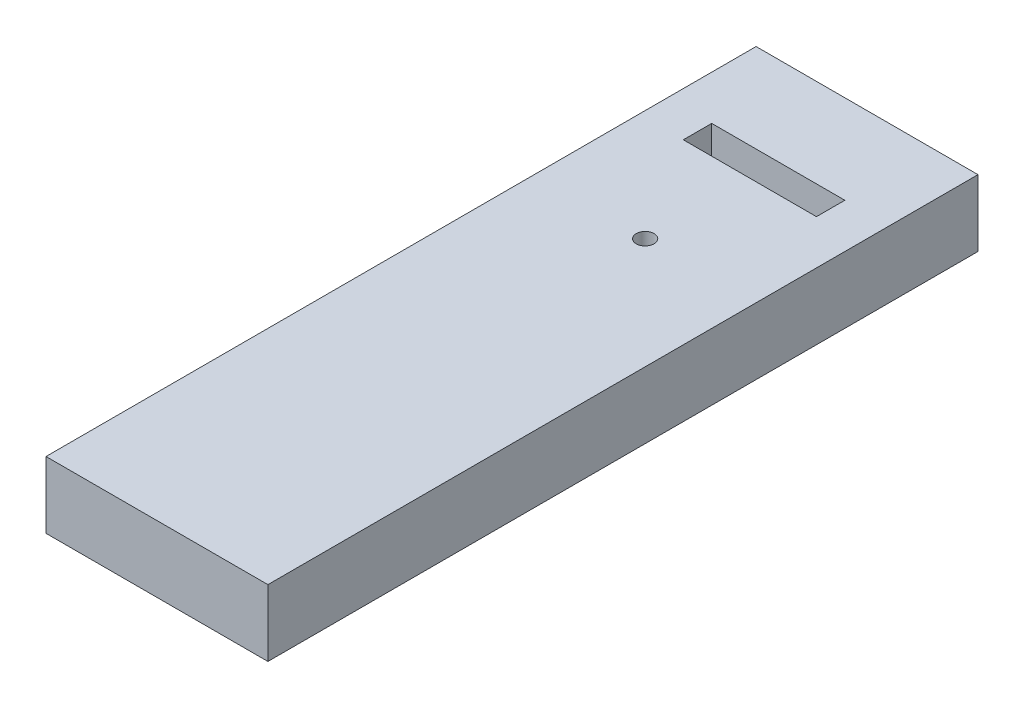
from build123d import *

# Parameters (mm, degrees)
SKETCH1_W                   = 63.5
SKETCH1_H                   = 203.2
BOSS_EXTRUDE1_DEPTH         = 19.05
SKETCH2_R                   = 4.7625
CUT_EXTRUDE1_DEPTH          = 25.4
CUT_EXTRUDE2_DEPTH          = 9.525
SKETCH5_W                   = 38.1
SKETCH5_H                   = 8.128
CUT_EXTRUDE4_DEPTH          = 109.136603424
SKETCH6_W                   = 53.975
SKETCH6_H                   = 29.845
CUT_EXTRUDE5_DEPTH          = 2.159
F_1_4_20_TAPPED_HOLE1_D     = 5.1054
F_1_4_20_TAPPED_HOLE1_DEPTH = 19.05
F_1_4_20_TAPPED_HOLE1_TIP   = 1.533816902


with BuildPart() as part:
    # Sketch1 → Boss-Extrude1 (new body)
    with BuildSketch(Plane(origin=(0, 0, 0), x_dir=(1, 0, 0), z_dir=(0, 1, 0))):
        Rectangle(SKETCH1_W, SKETCH1_H)
    extrude(amount=BOSS_EXTRUDE1_DEPTH)

    # Sketch2 → Cut-Extrude1 (cut)
    with BuildSketch(Plane(origin=(0, 0, -101.6), x_dir=(-1, 0, 0), z_dir=(0, 0, -1))):
        Circle(SKETCH2_R)
    extrude(amount=-CUT_EXTRUDE1_DEPTH, mode=Mode.SUBTRACT)

    # Sketch3 → Cut-Extrude2 (cut)
    with BuildSketch(Plane(origin=(0, 0, 0), x_dir=(-1, 0, 0), z_dir=(0, -1, 0))):
        with BuildLine():
            Line((-20.6375, -96.8375), (20.6375, -96.8375))
            ThreePointArc((20.6375, -96.8375), (25.127628061, -94.977628061), (26.9875, -90.4875))
            Line((26.9875, -90.4875), (26.9875, 41.402))
            ThreePointArc((26.9875, 41.402), (25.127628061, 45.892128061), (20.6375, 47.752))
            Line((20.6375, 47.752), (-20.6375, 47.752))
            ThreePointArc((-20.6375, 47.752), (-25.127628061, 45.892128061), (-26.9875, 41.402))
            Line((-26.9875, 41.402), (-26.9875, -90.4875))
            ThreePointArc((-26.9875, -90.4875), (-25.127628061, -94.977628061), (-20.6375, -96.8375))
        make_face()
        with BuildLine():
            Line((-23.8125, 76.2), (23.8125, 76.2))
            ThreePointArc((23.8125, 76.2), (26.05756403, 75.27006403), (26.9875, 73.025))
            Line((26.9875, 73.025), (26.9875, 71.247))
            ThreePointArc((26.9875, 71.247), (26.05756403, 69.00193597), (23.8125, 68.072))
            Line((23.8125, 68.072), (-23.8125, 68.072))
            ThreePointArc((-23.8125, 68.072), (-26.05756403, 69.00193597), (-26.9875, 71.247))
            Line((-26.9875, 71.247), (-26.9875, 73.025))
            ThreePointArc((-26.9875, 73.025), (-26.05756403, 75.27006403), (-23.8125, 76.2))
        make_face()
    extrude(amount=-CUT_EXTRUDE2_DEPTH, mode=Mode.SUBTRACT)

    # Sketch5 → Cut-Extrude4 (cut, through all)
    with BuildSketch(Plane(origin=(0, 0, 0), x_dir=(1, 0, 0), z_dir=(0, 1, 0))):
        with Locations((0, 72.136)):
            Rectangle(SKETCH5_W, SKETCH5_H)
    extrude(amount=CUT_EXTRUDE4_DEPTH, mode=Mode.SUBTRACT)

    # Sketch6 → Cut-Extrude5 (cut)
    with BuildSketch(Plane(origin=(0, 0, 0), x_dir=(1, 0, 0), z_dir=(0, 1, 0))):
        with Locations((0, 56.3245)):
            Rectangle(SKETCH6_W, SKETCH6_H)
    extrude(amount=CUT_EXTRUDE5_DEPTH, mode=Mode.SUBTRACT)

    # 1/4-20 Tapped Hole1
    with Locations(Plane(origin=(-11.034450397, 19.05, 14.547513529), x_dir=(-1, 0, 0), z_dir=(0, 1, 0))):
        with Locations((-11.034450397, -52.647513529)):
            Hole(F_1_4_20_TAPPED_HOLE1_D / 2, depth=F_1_4_20_TAPPED_HOLE1_DEPTH)
            with Locations((0, 0, -(F_1_4_20_TAPPED_HOLE1_DEPTH + F_1_4_20_TAPPED_HOLE1_TIP / 2))):  # 118° drill point
                Cone(0, F_1_4_20_TAPPED_HOLE1_D / 2, F_1_4_20_TAPPED_HOLE1_TIP, mode=Mode.SUBTRACT)


solid = part.part
